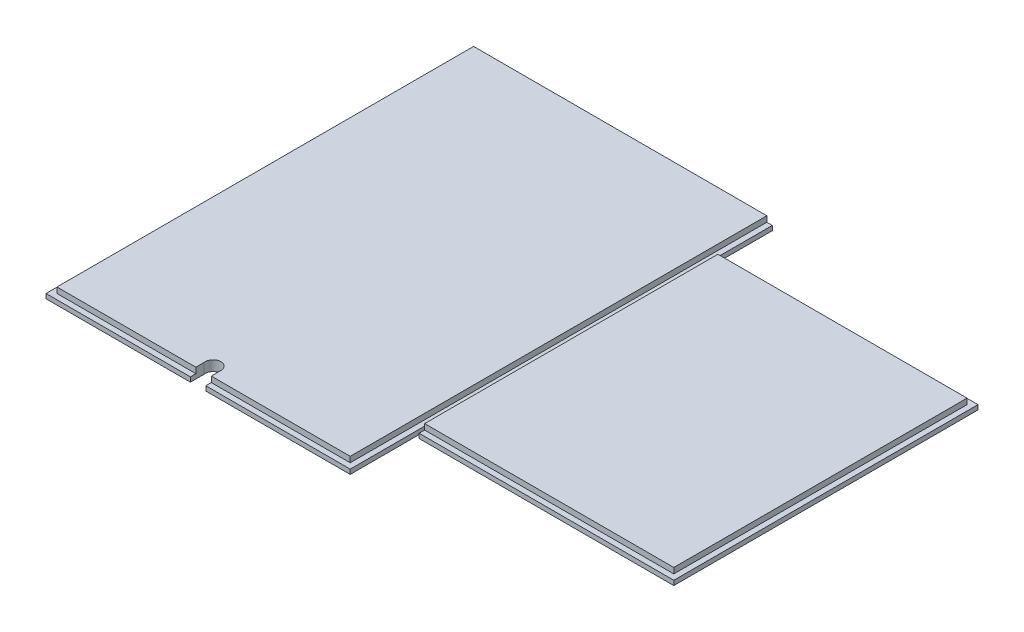
from build123d import *

# Parameters (mm, degrees)
CROQUIS1_W                = 89
CROQUIS1_H                = 123.5
SALIENTE_EXTRUIR1_DEPTH   = 3
CROQUIS1_W_2              = 74.5
CROQUIS1_H_2              = 89
SALIENTE_EXTRUIR1_2_DEPTH = 3
CORTAR_EXTRUIR1_DEPTH     = 1.65
CORTAR_EXTRUIR3_DEPTH     = 6


with BuildPart() as part:
    # Croquis1 → Saliente-Extruir1 (new body)
    with BuildSketch(Plane(origin=(0, 0, 0), x_dir=(1, 0, 0), z_dir=(0, 1, 0))):
        with Locations((-13.244966745, -11.862734426)):
            Rectangle(CROQUIS1_W, CROQUIS1_H)
    extrude(amount=SALIENTE_EXTRUIR1_DEPTH)


with BuildPart() as body_2:
    # Croquis1 → Saliente-Extruir1 2 (new body)
    with BuildSketch(Plane(origin=(0, 0, 0), x_dir=(1, 0, 0), z_dir=(0, 1, 0))):
        with Locations((69.505628415, -9.940468384)):
            Rectangle(CROQUIS1_W_2, CROQUIS1_H_2)
    extrude(amount=SALIENTE_EXTRUIR1_2_DEPTH)


with BuildPart() as cortar_extruir1_tool:
    # Croquis2 → Cortar-Extruir1 (new body)
    with BuildSketch(Plane(origin=(0, 3, 0), x_dir=(1, 0, 0), z_dir=(0, 1, 0))):
        Polygon((-57.744966745, 49.887265574), (-57.744966745, -73.612734426), (31.255033255, -73.612734426), (31.255033255, 49.887265574), (29.655033255, 49.887265574), (29.655033255, -72.012734426), (-56.144966745, -72.012734426), (-56.144966745, 49.887265574), align=None)
        Polygon((32.255628415, 34.559531616), (106.755628415, 34.559531616), (106.755628415, -54.440468384), (32.255628415, -54.440468384), (32.255628415, -52.840468384), (105.155628415, -52.840468384), (105.155628415, 32.959531616), (32.255628415, 32.959531616), align=None)
    extrude(amount=-CORTAR_EXTRUIR1_DEPTH)


with BuildPart() as part_1:
    add(part.part)

    # Cortar-Extruir1: cut by cortar_extruir1_tool
    add(cortar_extruir1_tool.part, mode=Mode.SUBTRACT)

    # Croquis3 → Cortar-Extruir3 (cut)
    with BuildSketch(Plane(origin=(0, 3, 0), x_dir=(1, 0, 0), z_dir=(0, 1, 0))):
        with BuildLine():
            Line((-15.494966745, -73.612734426), (-15.494966745, -69.612734426))
            ThreePointArc((-15.494966745, -69.612734426), (-13.244966745, -66.950228859), (-10.994966745, -69.612734426))
            Line((-10.994966745, -69.612734426), (-10.994966745, -73.612734426))
            Line((-10.994966745, -73.612734426), (-15.494966745, -73.612734426))
        make_face()
    extrude(amount=-CORTAR_EXTRUIR3_DEPTH, mode=Mode.SUBTRACT)


with BuildPart() as body_2_1:
    add(body_2.part)

    # Cortar-Extruir1: cut by cortar_extruir1_tool
    add(cortar_extruir1_tool.part, mode=Mode.SUBTRACT)


solid = Compound([part_1.part, body_2_1.part])
